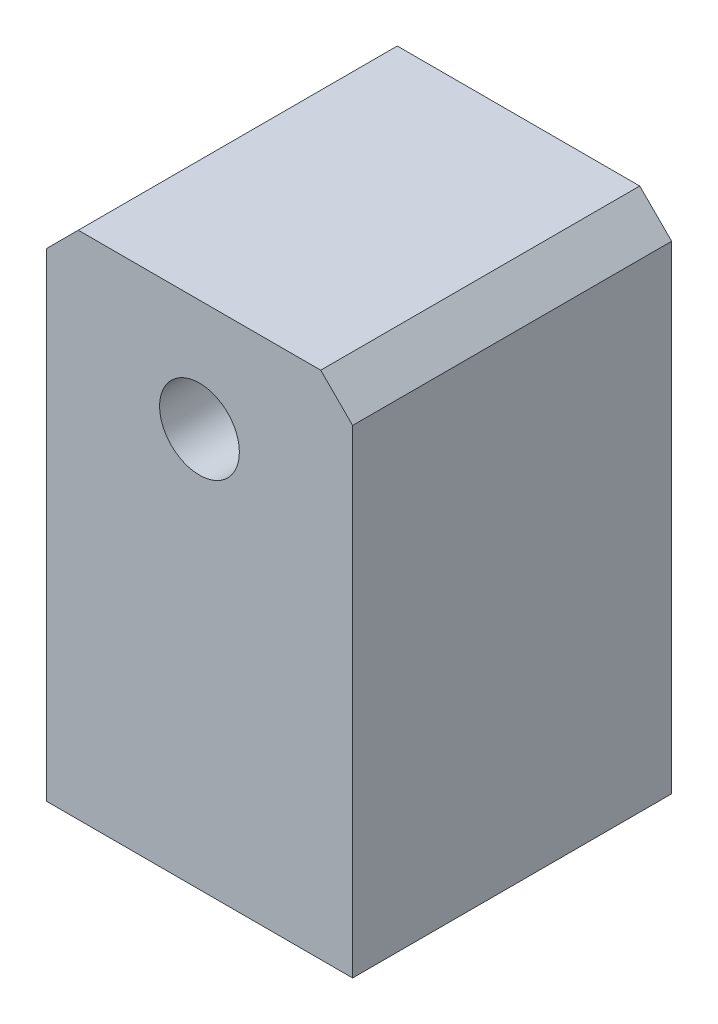
from build123d import *

# Parameters (mm, degrees)
SKETCH1_W           = 96
SKETCH1_H           = 160
BOSS_EXTRUDE1_DEPTH = 100
SKETCH2_R           = 12.5
CUT_EXTRUDE1_DEPTH  = 195.689496378
CHAMFER1_SIZE       = 10


with BuildPart() as part:
    # Sketch1 → Boss-Extrude1 (new body)
    with BuildSketch(Plane.XY):
        with Locations((0, 80)):
            Rectangle(SKETCH1_W, SKETCH1_H)
    extrude(amount=BOSS_EXTRUDE1_DEPTH)

    # Sketch2 → Cut-Extrude1 (cut, through all)
    with BuildSketch(Plane.XY.offset(100)):
        with Locations((0, 125)):
            Circle(SKETCH2_R)
    extrude(amount=-CUT_EXTRUDE1_DEPTH, mode=Mode.SUBTRACT)

    # Chamfer1
    chamfer1_edges = [part.edges().sort_by_distance(p)[0] for p in [
        (-48, 160, 50),
        (48, 160, 50),
    ]]
    chamfer(chamfer1_edges, length=CHAMFER1_SIZE)


solid = part.part
